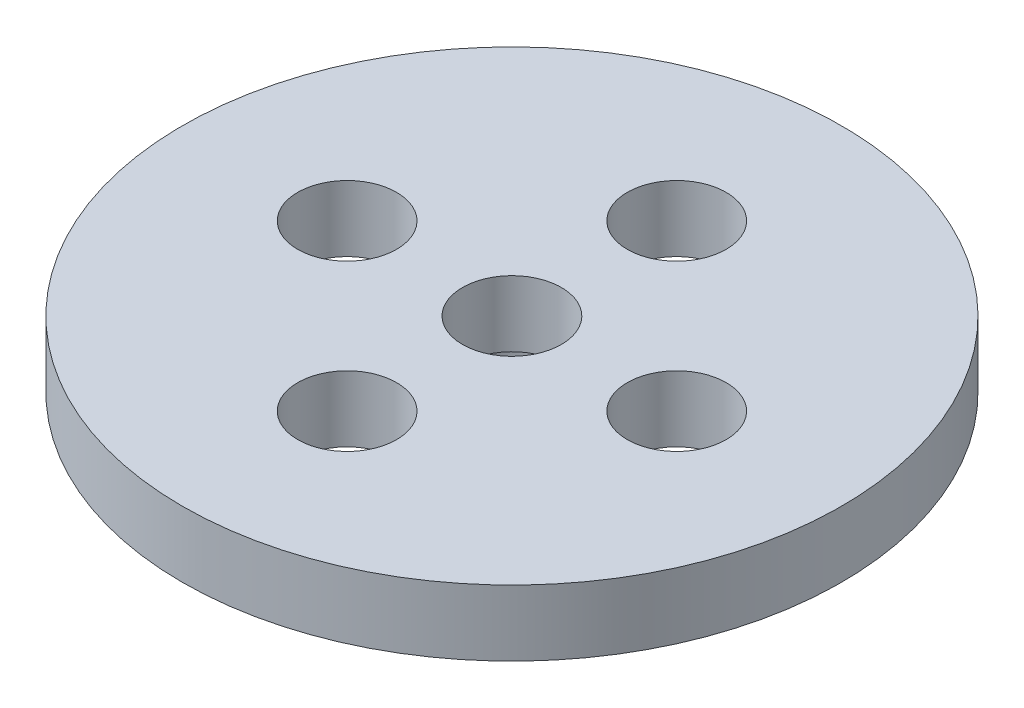
from build123d import *

# Parameters (mm, degrees)
IZIM1_R                     = 10
IZIM1_R_2                   = 1.5
Y_KSEKLIK_EKSTR_ZYON1_DEPTH = 2
IZIM2_R                     = 2.5
IZIM2_R_2                   = 1.724737241
Y_KSEKLIK_EKSTR_ZYON2_DEPTH = 2


with BuildPart() as part:
    # Çizim1 → Yükseklik-Ekstrüzyon1 (new body)
    with BuildSketch(Plane(origin=(0, 0, 0), x_dir=(1, 0, 0), z_dir=(0, 1, 0))):
        with Locations(Location((-0.153619206, 0.084194337, 0), (0, 0, 270))):
            Circle(IZIM1_R)
        with Locations(Location((-0.153619206, 0.084194337, 0), (0, 0, 270))):
            Circle(IZIM1_R_2, mode=Mode.SUBTRACT)
        with Locations(Location((-0.153619206, 5.084194337, 0), (0, 0, 270))):
            Circle(IZIM1_R_2, mode=Mode.SUBTRACT)
        with Locations(Location((-5.153619206, 0.084194337, 0), (0, 0, 270))):
            Circle(IZIM1_R_2, mode=Mode.SUBTRACT)
        with Locations(Location((4.846380794, 0.084194337, 0), (0, 0, 270))):
            Circle(IZIM1_R_2, mode=Mode.SUBTRACT)
        with Locations(Location((-0.153619206, -4.915805663, 0), (0, 0, 270))):
            Circle(IZIM1_R_2, mode=Mode.SUBTRACT)
    extrude(amount=Y_KSEKLIK_EKSTR_ZYON1_DEPTH)

    # Çizim2 → Yükseklik-Ekstrüzyon2 (add)
    with BuildSketch(Plane.XZ):
        with Locations(Location((-0.153619206, -0.084194337, 0), (0, 0, 90))):
            Circle(IZIM2_R)
        with Locations(Location((-0.153619206, -0.084194337, 0), (0, 0, 270))):
            Circle(IZIM2_R_2, mode=Mode.SUBTRACT)
    extrude(amount=Y_KSEKLIK_EKSTR_ZYON2_DEPTH)


solid = part.part
